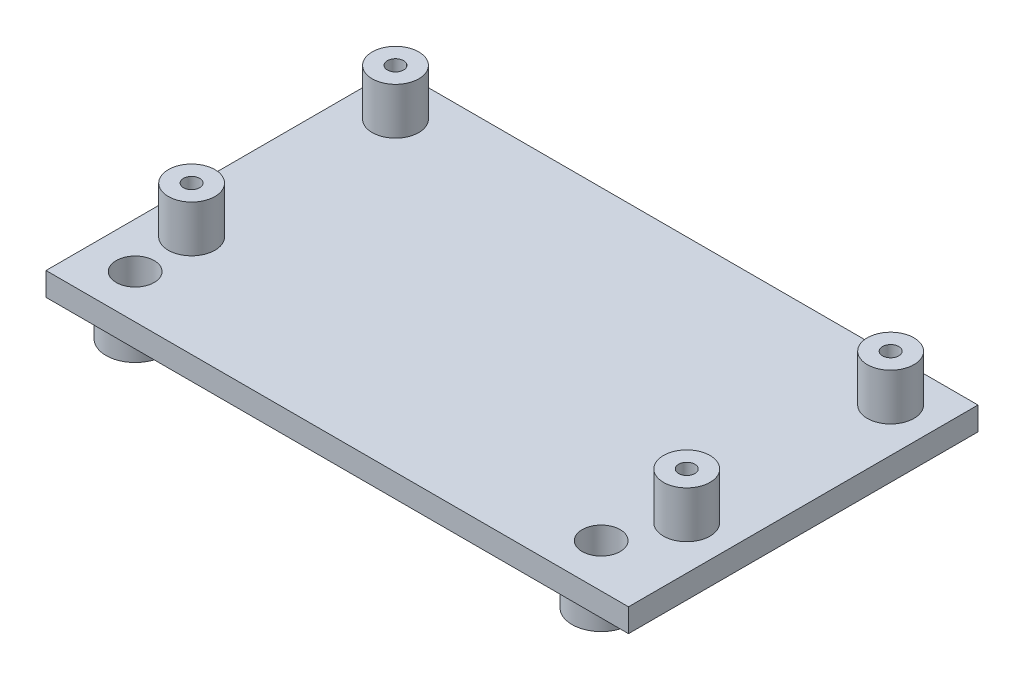
from build123d import *

# Parameters (mm, degrees)
SKETCH1_R              = 2
BOSS_EXTRUDE1_DEPTH    = 4
BOSS_EXTRUDE1_2_DEPTH  = 4
BOSS_EXTRUDE1_3_DEPTH  = 4
BOSS_EXTRUDE1_4_DEPTH  = 4
SKETCH2_W              = 50
SKETCH2_H              = 30
BOSS_EXTRUDE2_DEPTH    = 2
F_00_CLEARANCE_HOLE2_D = 1.397
SKETCH9_R              = 2.5
BOSS_EXTRUDE3_DEPTH    = 3
F_4_CLEARANCE_HOLE1_D  = 3.2639


with BuildPart() as part:
    # Sketch1 → Boss-Extrude1 (new body)
    with BuildSketch(Plane(origin=(0, 0, 0), x_dir=(1, 0, 0), z_dir=(0, 1, 0))):
        with Locations(Location((3.75, 26.25, 0), (0, 0, 270))):
            Circle(SKETCH1_R)
    extrude(amount=BOSS_EXTRUDE1_DEPTH)



with BuildPart() as body_2:
    # Sketch1 → Boss-Extrude1 2 (new body)
    with BuildSketch(Plane(origin=(0, 0, 0), x_dir=(1, 0, 0), z_dir=(0, 1, 0))):
        with Locations(Location((46.25, 26.25, 0), (0, 0, 270))):
            Circle(SKETCH1_R)
    extrude(amount=BOSS_EXTRUDE1_2_DEPTH)


with BuildPart() as body_3:
    # Sketch1 → Boss-Extrude1 3 (new body)
    with BuildSketch(Plane(origin=(0, 0, 0), x_dir=(1, 0, 0), z_dir=(0, 1, 0))):
        with Locations(Location((46.25, 8.75, 0), (0, 0, 270))):
            Circle(SKETCH1_R)
    extrude(amount=BOSS_EXTRUDE1_3_DEPTH)


with BuildPart() as body_4:
    # Sketch1 → Boss-Extrude1 4 (new body)
    with BuildSketch(Plane(origin=(0, 0, 0), x_dir=(1, 0, 0), z_dir=(0, 1, 0))):
        with Locations(Location((3.75, 8.75, 0), (0, 0, 270))):
            Circle(SKETCH1_R)
    extrude(amount=BOSS_EXTRUDE1_4_DEPTH)


with BuildPart() as part_1:
    add(part.part)

    add(body_2.part)  # Boss-Extrude2 merges body 2

    add(body_3.part)  # Boss-Extrude2 merges body 3

    add(body_4.part)  # Boss-Extrude2 merges body 4
    # Sketch2 → Boss-Extrude2 (add)
    with BuildSketch(Plane(origin=(0, 0, 0), x_dir=(1, 0, 0), z_dir=(0, 1, 0))):
        with Locations((25, 15)):
            Rectangle(SKETCH2_W, SKETCH2_H)
    extrude(amount=-BOSS_EXTRUDE2_DEPTH)

    # #00 Clearance Hole2 (through all)
    with Locations(Plane(origin=(0, 4, 0), x_dir=(1, 0, 0), z_dir=(0, 1, 0))):
        with Locations((3.75, 26.25), (46.25, 26.25), (46.25, 8.75), (3.75, 8.75)):
            Hole(F_00_CLEARANCE_HOLE2_D / 2)

    # Sketch9 → Boss-Extrude3 (add)
    with BuildSketch(Plane.XZ.offset(2)):
        with Locations(Location((3.905878753, -3.75, 0), (0, 0, 90))):
            Circle(SKETCH9_R)
        with Locations(Location((43.905878753, -3.75, 0), (0, 0, 90))):
            Circle(SKETCH9_R)
    extrude(amount=BOSS_EXTRUDE3_DEPTH)

    # #4 Clearance Hole1 (through all)
    with Locations(Plane(origin=(0, -5, 0), x_dir=(-1, 0, 0), z_dir=(0, -1, 0))):
        with Locations((-3.905878753, 3.75), (-43.905878753, 3.75)):
            Hole(F_4_CLEARANCE_HOLE1_D / 2)


solid = part_1.part
